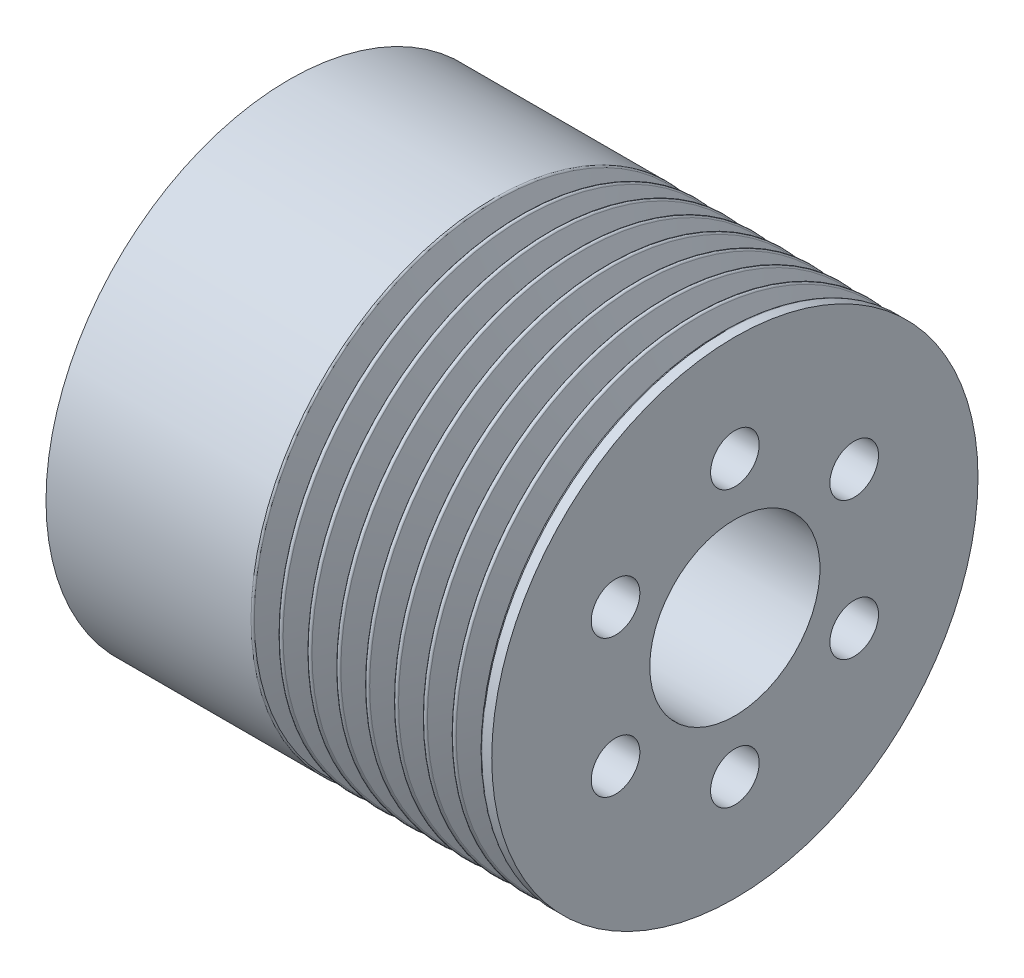
from build123d import *

# Parameters (mm, degrees)
LPATTERN1_COUNT    = 8
LPATTERN1_PITCH    = 3.56
SKETCH3_R          = 3
CUT_EXTRUDE1_DEPTH = 17.5


with BuildPart() as part:
    # Sketch1 → Revolve1 (revolve)
    with BuildSketch(Plane.XY, mode=Mode.PRIVATE) as revolve1_sk:
        Polygon((49, 10.5), (49, 30), (-6, 30), (-6, 21.5), (31.5, 21.5), (31.5, 10.5), align=None)
    revolve(revolve1_sk.sketch.rotate(Axis((0, 0, 0), (1, 0, 0)), 90), axis=Axis((0, 0, 0), (1, 0, 0)))

    # Sketch2 → Cut-Revolve1 (revolve, cut)
    with BuildSketch(Plane.XY, mode=Mode.PRIVATE) as cut_revolve1_sk:
        with BuildLine():
            Line((47.545076845, 29.835505036), (46.281907786, 26.36497657))
            ThreePointArc((46.281907786, 26.36497657), (46, 26.167582613), (45.718092214, 26.36497657))
            Line((45.718092214, 26.36497657), (44.454923155, 29.835505036))
            ThreePointArc((44.454923155, 29.835505036), (44.363394109, 29.954788011), (44.22, 30))
            Line((44.22, 30), (47.78, 30))
            ThreePointArc((47.78, 30), (47.636605891, 29.954788011), (47.545076845, 29.835505036))
        make_face()
    cut_revolve1 = revolve(cut_revolve1_sk.sketch.rotate(Axis((0, 0, 0), (1, 0, 0)), 90), axis=Axis((0, 0, 0), (1, 0, 0)), mode=Mode.SUBTRACT)

    # LPattern1: Cut-Revolve1 ×8
    with Locations(*[(-i * LPATTERN1_PITCH, 0, 0) for i in range(1, LPATTERN1_COUNT)]):
        add(cut_revolve1, mode=Mode.SUBTRACT)

    # Sketch3 → Cut-Extrude1 (cut)
    with BuildSketch(Plane(origin=(49, 0, 0), x_dir=(0, 0, -1), z_dir=(1, 0, 0))):
        with Locations((0, 17)):
            Circle(SKETCH3_R)
        with Locations((14.722431864, 8.5)):
            Circle(SKETCH3_R)
        with Locations((14.722431864, -8.5)):
            Circle(SKETCH3_R)
        with Locations((0, -17)):
            Circle(SKETCH3_R)
        with Locations((-14.722431864, -8.5)):
            Circle(SKETCH3_R)
        with Locations((-14.722431864, 8.5)):
            Circle(SKETCH3_R)
    extrude(amount=-CUT_EXTRUDE1_DEPTH, mode=Mode.SUBTRACT)


solid = part.part
